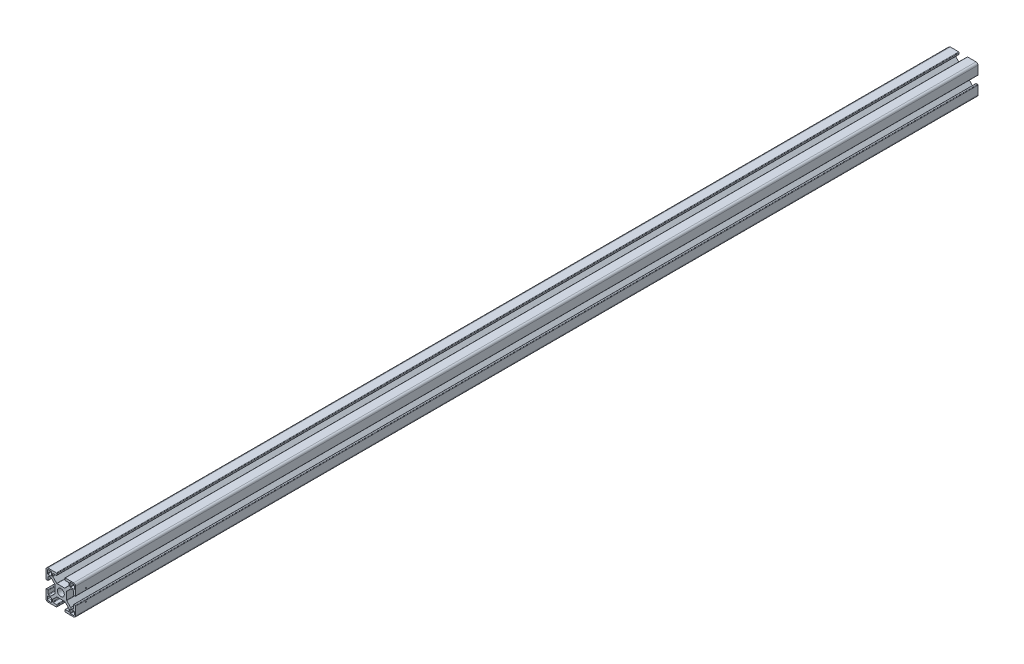
from build123d import *

# Parameters (mm, degrees)
SKETCH1_R                    = 3.52998588
BOSS_EXTRUDE1_DEPTH          = 457.2
M1_2X0_25_TAPPED_HOLE1_D     = 0.95
M1_2X0_25_TAPPED_HOLE1_DEPTH = 2.25746535


with BuildPart() as part:
    # Sketch1 → Boss-Extrude1 (new, symmetric)
    with BuildSketch(Plane.XY):
        with BuildLine():
            Line((14.49994, -4), (13.24247465, -4))
            ThreePointArc((13.24247465, -4), (12.88892126, -4.146446609), (12.74247465, -4.5))
            Line((12.74247465, -4.5), (12.74247465, -7.732519321))
            ThreePointArc((12.74247465, -7.732519321), (12.602449697, -8.097296796), (12.242781236, -8.249967))
            Line((12.242781236, -8.249967), (10.260188032, -8.249967))
            ThreePointArc((10.260188032, -8.249967), (10.068847082, -8.211906919), (9.906636056, -8.103520976))
            Line((9.906636056, -8.103520976), (5.981117769, -4.178002689))
            ThreePointArc((5.981117769, -4.178002689), (5.872731827, -4.015791664), (5.834671745, -3.824450713))
            Line((5.834671745, -3.824450713), (5.834671745, -1.01249595))
            Line((5.834671745, -1.01249595), (5.834671745, 0.88749645))
            Line((5.834671745, 0.88749645), (5.834671745, 3.824450713))
            ThreePointArc((5.834671745, 3.824450713), (5.872731827, 4.015791664), (5.981117769, 4.178002689))
            Line((5.981117769, 4.178002689), (9.906636056, 8.103520976))
            ThreePointArc((9.906636056, 8.103520976), (10.068847082, 8.211906919), (10.260188032, 8.249967))
            Line((10.260188032, 8.249967), (12.242781236, 8.249967))
            ThreePointArc((12.242781236, 8.249967), (12.602449697, 8.097296796), (12.74247465, 7.732519321))
            Line((12.74247465, 7.732519321), (12.74247465, 4.5))
            ThreePointArc((12.74247465, 4.5), (12.88892126, 4.146446609), (13.24247465, 4))
            Line((13.24247465, 4), (14.49994, 4))
            ThreePointArc((14.49994, 4), (14.853493391, 4.146446609), (14.99994, 4.5))
            Line((14.99994, 4.5), (14.99994, 12.999948))
            ThreePointArc((14.99994, 12.999948), (14.414155906, 14.414155906), (12.999948, 14.99994))
            Line((12.999948, 14.99994), (4.5, 14.99994))
            ThreePointArc((4.5, 14.99994), (4.146446609, 14.853493391), (4, 14.49994))
            Line((4, 14.49994), (4, 13.24247465))
            ThreePointArc((4, 13.24247465), (4.146446609, 12.88892126), (4.5, 12.74247465))
            Line((4.5, 12.74247465), (7.732519321, 12.74247465))
            ThreePointArc((7.732519321, 12.74247465), (8.097296796, 12.602449697), (8.249967, 12.242781236))
            Line((8.249967, 12.242781236), (8.249967, 10.260188032))
            ThreePointArc((8.249967, 10.260188032), (8.211906919, 10.068847082), (8.103520976, 9.906636056))
            Line((8.103520976, 9.906636056), (4.178002689, 5.981117769))
            ThreePointArc((4.178002689, 5.981117769), (4.015791664, 5.872731827), (3.824450713, 5.834671745))
            Line((3.824450713, 5.834671745), (0.9499962, 5.834671745))
            Line((0.9499962, 5.834671745), (-0.9499962, 5.834671745))
            Line((-0.9499962, 5.834671745), (-3.824450713, 5.834671745))
            ThreePointArc((-3.824450713, 5.834671745), (-4.015791664, 5.872731827), (-4.178002689, 5.981117769))
            Line((-4.178002689, 5.981117769), (-8.103520976, 9.906636056))
            ThreePointArc((-8.103520976, 9.906636056), (-8.211906919, 10.068847082), (-8.249967, 10.260188032))
            Line((-8.249967, 10.260188032), (-8.249967, 12.242781236))
            ThreePointArc((-8.249967, 12.242781236), (-8.097296796, 12.602449697), (-7.732519321, 12.74247465))
            Line((-7.732519321, 12.74247465), (-4.5, 12.74247465))
            ThreePointArc((-4.5, 12.74247465), (-4.146446609, 12.88892126), (-4, 13.24247465))
            Line((-4, 13.24247465), (-4, 14.49994))
            ThreePointArc((-4, 14.49994), (-4.146446609, 14.853493391), (-4.5, 14.99994))
            Line((-4.5, 14.99994), (-12.999948, 14.99994))
            ThreePointArc((-12.999948, 14.99994), (-14.414155906, 14.414155906), (-14.99994, 12.999948))
            Line((-14.99994, 12.999948), (-14.99994, 4.5))
            ThreePointArc((-14.99994, 4.5), (-14.853493391, 4.146446609), (-14.49994, 4))
            Line((-14.49994, 4), (-13.24247465, 4))
            ThreePointArc((-13.24247465, 4), (-12.88892126, 4.146446609), (-12.74247465, 4.5))
            Line((-12.74247465, 4.5), (-12.74247465, 7.732519321))
            ThreePointArc((-12.74247465, 7.732519321), (-12.602449697, 8.097296796), (-12.242781236, 8.249967))
            Line((-12.242781236, 8.249967), (-10.260188032, 8.249967))
            ThreePointArc((-10.260188032, 8.249967), (-10.068847082, 8.211906919), (-9.906636056, 8.103520976))
            Line((-9.906636056, 8.103520976), (-5.981117769, 4.178002689))
            ThreePointArc((-5.981117769, 4.178002689), (-5.872731827, 4.015791664), (-5.834671745, 3.824450713))
            Line((-5.834671745, 3.824450713), (-5.834671745, 0.88749645))
            Line((-5.834671745, 0.88749645), (-5.834671745, -1.01249595))
            Line((-5.834671745, -1.01249595), (-5.834671745, -3.824450713))
            ThreePointArc((-5.834671745, -3.824450713), (-5.872731827, -4.015791664), (-5.981117769, -4.178002689))
            Line((-5.981117769, -4.178002689), (-9.906636056, -8.103520976))
            ThreePointArc((-9.906636056, -8.103520976), (-10.068847082, -8.211906919), (-10.260188032, -8.249967))
            Line((-10.260188032, -8.249967), (-12.242781236, -8.249967))
            ThreePointArc((-12.242781236, -8.249967), (-12.602449697, -8.097296796), (-12.74247465, -7.732519321))
            Line((-12.74247465, -7.732519321), (-12.74247465, -4.5))
            ThreePointArc((-12.74247465, -4.5), (-12.88892126, -4.146446609), (-13.24247465, -4))
            Line((-13.24247465, -4), (-14.49994, -4))
            ThreePointArc((-14.49994, -4), (-14.853493391, -4.146446609), (-14.99994, -4.5))
            Line((-14.99994, -4.5), (-14.99994, -12.999948))
            ThreePointArc((-14.99994, -12.999948), (-14.414155906, -14.414155906), (-12.999948, -14.99994))
            Line((-12.999948, -14.99994), (-4.5, -14.99994))
            ThreePointArc((-4.5, -14.99994), (-4.146446609, -14.853493391), (-4, -14.49994))
            Line((-4, -14.49994), (-4, -13.24247465))
            ThreePointArc((-4, -13.24247465), (-4.146446609, -12.88892126), (-4.5, -12.74247465))
            Line((-4.5, -12.74247465), (-7.732519321, -12.74247465))
            ThreePointArc((-7.732519321, -12.74247465), (-8.097296796, -12.602449697), (-8.249967, -12.242781236))
            Line((-8.249967, -12.242781236), (-8.249967, -10.260188032))
            ThreePointArc((-8.249967, -10.260188032), (-8.211906919, -10.068847082), (-8.103520976, -9.906636056))
            Line((-8.103520976, -9.906636056), (-4.178002689, -5.981117769))
            ThreePointArc((-4.178002689, -5.981117769), (-4.015791664, -5.872731827), (-3.824450713, -5.834671745))
            Line((-3.824450713, -5.834671745), (-0.9499962, -5.834671745))
            Line((-0.9499962, -5.834671745), (0.9499962, -5.834671745))
            Line((0.9499962, -5.834671745), (3.824450713, -5.834671745))
            ThreePointArc((3.824450713, -5.834671745), (4.015791664, -5.872731827), (4.178002689, -5.981117769))
            Line((4.178002689, -5.981117769), (8.103520976, -9.906636056))
            ThreePointArc((8.103520976, -9.906636056), (8.211906919, -10.068847082), (8.249967, -10.260188032))
            Line((8.249967, -10.260188032), (8.249967, -12.242781236))
            ThreePointArc((8.249967, -12.242781236), (8.097296796, -12.602449697), (7.732519321, -12.74247465))
            Line((7.732519321, -12.74247465), (4.5, -12.74247465))
            ThreePointArc((4.5, -12.74247465), (4.146446609, -12.88892126), (4, -13.24247465))
            Line((4, -13.24247465), (4, -14.49994))
            ThreePointArc((4, -14.49994), (4.146446609, -14.853493391), (4.5, -14.99994))
            Line((4.5, -14.99994), (12.999948, -14.99994))
            ThreePointArc((12.999948, -14.99994), (14.414155906, -14.414155906), (14.99994, -12.999948))
            Line((14.99994, -12.999948), (14.99994, -4.5))
            ThreePointArc((14.99994, -4.5), (14.853493391, -4.146446609), (14.49994, -4))
        make_face()
        Circle(SKETCH1_R, mode=Mode.SUBTRACT)
        with BuildLine():
            Line((-12.6999492, -13.6999452), (-9.880960476, -13.6999452))
            ThreePointArc((-9.880960476, -13.6999452), (-9.61155387, -13.58835333), (-9.499962, -13.318946724))
            Line((-9.499962, -13.318946724), (-9.499962, -9.87996048))
            ThreePointArc((-9.499962, -9.87996048), (-9.611260978, -9.611260978), (-9.87996048, -9.499962))
            Line((-9.87996048, -9.499962), (-13.318946724, -9.499962))
            ThreePointArc((-13.318946724, -9.499962), (-13.58835333, -9.61155387), (-13.6999452, -9.880960476))
            Line((-13.6999452, -9.880960476), (-13.6999452, -12.6999492))
            ThreePointArc((-13.6999452, -12.6999492), (-13.407053153, -13.407053153), (-12.6999492, -13.6999452))
        make_face(mode=Mode.SUBTRACT)
        with BuildLine():
            Line((13.6999452, -12.6999492), (13.6999452, -9.880960476))
            ThreePointArc((13.6999452, -9.880960476), (13.58835333, -9.61155387), (13.318946724, -9.499962))
            Line((13.318946724, -9.499962), (9.87996048, -9.499962))
            ThreePointArc((9.87996048, -9.499962), (9.611260978, -9.611260978), (9.499962, -9.87996048))
            Line((9.499962, -9.87996048), (9.499962, -13.318946724))
            ThreePointArc((9.499962, -13.318946724), (9.61155387, -13.58835333), (9.880960476, -13.6999452))
            Line((9.880960476, -13.6999452), (12.6999492, -13.6999452))
            ThreePointArc((12.6999492, -13.6999452), (13.407053153, -13.407053153), (13.6999452, -12.6999492))
        make_face(mode=Mode.SUBTRACT)
        with BuildLine():
            Line((9.87996048, 9.499962), (13.318946724, 9.499962))
            ThreePointArc((13.318946724, 9.499962), (13.58835333, 9.61155387), (13.6999452, 9.880960476))
            Line((13.6999452, 9.880960476), (13.6999452, 12.6999492))
            ThreePointArc((13.6999452, 12.6999492), (13.407053153, 13.407053153), (12.6999492, 13.6999452))
            Line((12.6999492, 13.6999452), (9.880960476, 13.6999452))
            ThreePointArc((9.880960476, 13.6999452), (9.61155387, 13.58835333), (9.499962, 13.318946724))
            Line((9.499962, 13.318946724), (9.499962, 9.87996048))
            ThreePointArc((9.499962, 9.87996048), (9.611260978, 9.611260978), (9.87996048, 9.499962))
        make_face(mode=Mode.SUBTRACT)
        with BuildLine():
            Line((-13.6999452, 12.6999492), (-13.6999452, 9.880960476))
            ThreePointArc((-13.6999452, 9.880960476), (-13.58835333, 9.61155387), (-13.318946724, 9.499962))
            Line((-13.318946724, 9.499962), (-9.87996048, 9.499962))
            ThreePointArc((-9.87996048, 9.499962), (-9.611260978, 9.611260978), (-9.499962, 9.87996048))
            Line((-9.499962, 9.87996048), (-9.499962, 13.318946724))
            ThreePointArc((-9.499962, 13.318946724), (-9.61155387, 13.58835333), (-9.880960476, 13.6999452))
            Line((-9.880960476, 13.6999452), (-12.6999492, 13.6999452))
            ThreePointArc((-12.6999492, 13.6999452), (-13.407053153, 13.407053153), (-13.6999452, 12.6999492))
        make_face(mode=Mode.SUBTRACT)
    extrude(amount=BOSS_EXTRUDE1_DEPTH, both=True)

    # M1.2x0.25 Tapped Hole1
    with Locations(Plane(origin=(14.99994, 6.115, 446.77), x_dir=(0, 0, 1), z_dir=(1, 0, 0))):
        with Locations((0, 0), (0, 12.23)):
            Hole(M1_2X0_25_TAPPED_HOLE1_D / 2, depth=M1_2X0_25_TAPPED_HOLE1_DEPTH)


solid = part.part
